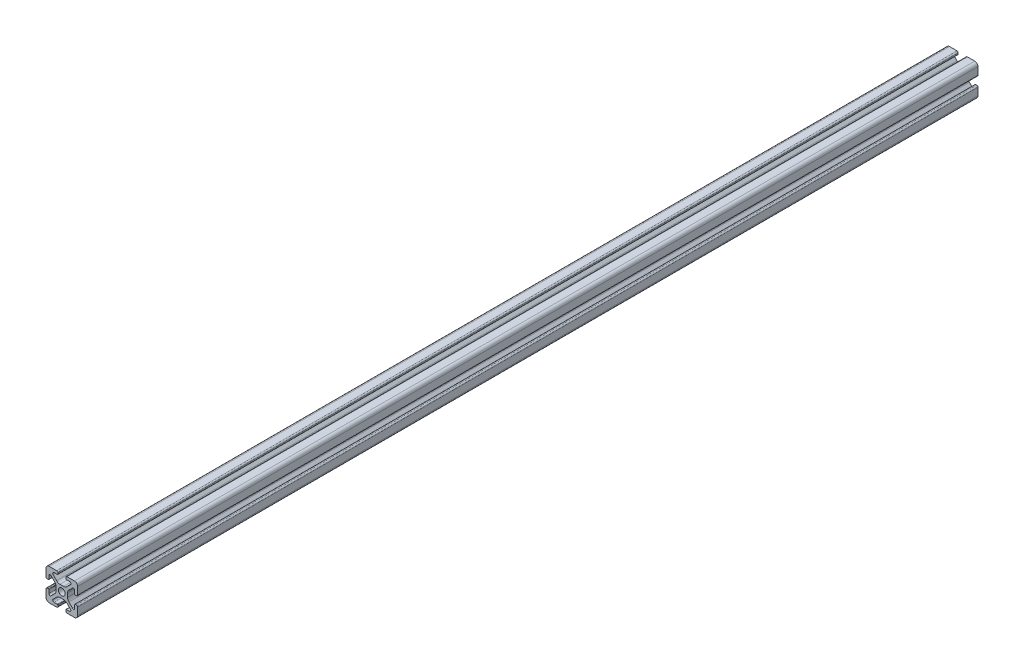
from build123d import *

# Parameters (mm, degrees)
SKETCH1_R           = 2.1463
BOSS_EXTRUDE1_DEPTH = 284.8102


with BuildPart() as part:
    # Sketch1 → Boss-Extrude1 (new, symmetric)
    with BuildSketch(Plane.XY):
        with BuildLine():
            Line((-9.9949, 7.9883), (-9.9949, 3.2893))
            ThreePointArc((-9.9949, 3.2893), (-9.76427588, 2.73252412), (-9.2075, 2.5019))
            Line((-9.2075, 2.5019), (-8.4963, 2.5019))
            ThreePointArc((-8.4963, 2.5019), (-8.280773853, 2.591173853), (-8.1915, 2.8067))
            Line((-8.1915, 2.8067), (-8.1915, 4.9149))
            ThreePointArc((-8.1915, 4.9149), (-7.674065253, 5.689295824), (-6.760603096, 5.507596904))
            Line((-6.760603096, 5.507596904), (-4.505765747, 3.252759555))
            ThreePointArc((-4.505765747, 3.252759555), (-3.856054457, 2.280397894), (-3.627906192, 1.133419111))
            Line((-3.627906192, 1.133419111), (-3.627906192, -1.133419111))
            ThreePointArc((-3.627906192, -1.133419111), (-3.856054457, -2.280397894), (-4.505765747, -3.252759555))
            Line((-4.505765747, -3.252759555), (-6.760603096, -5.507596904))
            ThreePointArc((-6.760603096, -5.507596904), (-7.674065253, -5.689295824), (-8.1915, -4.9149))
            Line((-8.1915, -4.9149), (-8.1915, -2.8067))
            ThreePointArc((-8.1915, -2.8067), (-8.280773853, -2.591173853), (-8.4963, -2.5019))
            Line((-8.4963, -2.5019), (-9.2075, -2.5019))
            ThreePointArc((-9.2075, -2.5019), (-9.76427588, -2.73252412), (-9.9949, -3.2893))
            Line((-9.9949, -3.2893), (-9.9949, -7.9883))
            ThreePointArc((-9.9949, -7.9883), (-9.407180467, -9.407180467), (-7.9883, -9.9949))
            Line((-7.9883, -9.9949), (-3.2893, -9.9949))
            ThreePointArc((-3.2893, -9.9949), (-2.73252412, -9.76427588), (-2.5019, -9.2075))
            Line((-2.5019, -9.2075), (-2.5019, -8.4963))
            ThreePointArc((-2.5019, -8.4963), (-2.591173853, -8.280773853), (-2.8067, -8.1915))
            Line((-2.8067, -8.1915), (-4.9149, -8.1915))
            ThreePointArc((-4.9149, -8.1915), (-5.689295824, -7.674065253), (-5.507596904, -6.760603096))
            Line((-5.507596904, -6.760603096), (-3.252759555, -4.505765747))
            ThreePointArc((-3.252759555, -4.505765747), (-2.280397894, -3.856054457), (-1.133419111, -3.627906192))
            Line((-1.133419111, -3.627906192), (1.133419111, -3.627906192))
            ThreePointArc((1.133419111, -3.627906192), (2.280397894, -3.856054457), (3.252759555, -4.505765747))
            Line((3.252759555, -4.505765747), (5.507596904, -6.760603096))
            ThreePointArc((5.507596904, -6.760603096), (5.689295824, -7.674065253), (4.9149, -8.1915))
            Line((4.9149, -8.1915), (2.8067, -8.1915))
            ThreePointArc((2.8067, -8.1915), (2.591173853, -8.280773853), (2.5019, -8.4963))
            Line((2.5019, -8.4963), (2.5019, -9.2075))
            ThreePointArc((2.5019, -9.2075), (2.73252412, -9.76427588), (3.2893, -9.9949))
            Line((3.2893, -9.9949), (7.9883, -9.9949))
            ThreePointArc((7.9883, -9.9949), (9.407180467, -9.407180467), (9.9949, -7.9883))
            Line((9.9949, -7.9883), (9.9949, -3.2893))
            ThreePointArc((9.9949, -3.2893), (9.76427588, -2.73252412), (9.2075, -2.5019))
            Line((9.2075, -2.5019), (8.4963, -2.5019))
            ThreePointArc((8.4963, -2.5019), (8.280773853, -2.591173853), (8.1915, -2.8067))
            Line((8.1915, -2.8067), (8.1915, -4.9149))
            ThreePointArc((8.1915, -4.9149), (7.674065253, -5.689295824), (6.760603096, -5.507596904))
            Line((6.760603096, -5.507596904), (4.505765747, -3.252759555))
            ThreePointArc((4.505765747, -3.252759555), (3.856054457, -2.280397894), (3.627906192, -1.133419111))
            Line((3.627906192, -1.133419111), (3.627906192, 1.133419111))
            ThreePointArc((3.627906192, 1.133419111), (3.856054457, 2.280397894), (4.505765747, 3.252759555))
            Line((4.505765747, 3.252759555), (6.760603096, 5.507596904))
            ThreePointArc((6.760603096, 5.507596904), (7.674065253, 5.689295824), (8.1915, 4.9149))
            Line((8.1915, 4.9149), (8.1915, 2.8067))
            ThreePointArc((8.1915, 2.8067), (8.280773853, 2.591173853), (8.4963, 2.5019))
            Line((8.4963, 2.5019), (9.2075, 2.5019))
            ThreePointArc((9.2075, 2.5019), (9.76427588, 2.73252412), (9.9949, 3.2893))
            Line((9.9949, 3.2893), (9.9949, 7.9883))
            ThreePointArc((9.9949, 7.9883), (9.407180467, 9.407180467), (7.9883, 9.9949))
            Line((7.9883, 9.9949), (3.2893, 9.9949))
            ThreePointArc((3.2893, 9.9949), (2.73252412, 9.76427588), (2.5019, 9.2075))
            Line((2.5019, 9.2075), (2.5019, 8.4963))
            ThreePointArc((2.5019, 8.4963), (2.591173853, 8.280773853), (2.8067, 8.1915))
            Line((2.8067, 8.1915), (4.9149, 8.1915))
            ThreePointArc((4.9149, 8.1915), (5.689295824, 7.674065253), (5.507596904, 6.760603096))
            Line((5.507596904, 6.760603096), (3.252759555, 4.505765747))
            ThreePointArc((3.252759555, 4.505765747), (2.280397894, 3.856054457), (1.133419111, 3.627906192))
            Line((1.133419111, 3.627906192), (-1.133419111, 3.627906192))
            ThreePointArc((-1.133419111, 3.627906192), (-2.280397894, 3.856054457), (-3.252759555, 4.505765747))
            Line((-3.252759555, 4.505765747), (-5.507596904, 6.760603096))
            ThreePointArc((-5.507596904, 6.760603096), (-5.689295824, 7.674065253), (-4.9149, 8.1915))
            Line((-4.9149, 8.1915), (-2.8067, 8.1915))
            ThreePointArc((-2.8067, 8.1915), (-2.591173853, 8.280773853), (-2.5019, 8.4963))
            Line((-2.5019, 8.4963), (-2.5019, 9.2075))
            ThreePointArc((-2.5019, 9.2075), (-2.73252412, 9.76427588), (-3.2893, 9.9949))
            Line((-3.2893, 9.9949), (-7.9883, 9.9949))
            ThreePointArc((-7.9883, 9.9949), (-9.407180467, 9.407180467), (-9.9949, 7.9883))
        make_face()
        Circle(SKETCH1_R, mode=Mode.SUBTRACT)
    extrude(amount=BOSS_EXTRUDE1_DEPTH, both=True)


solid = part.part
